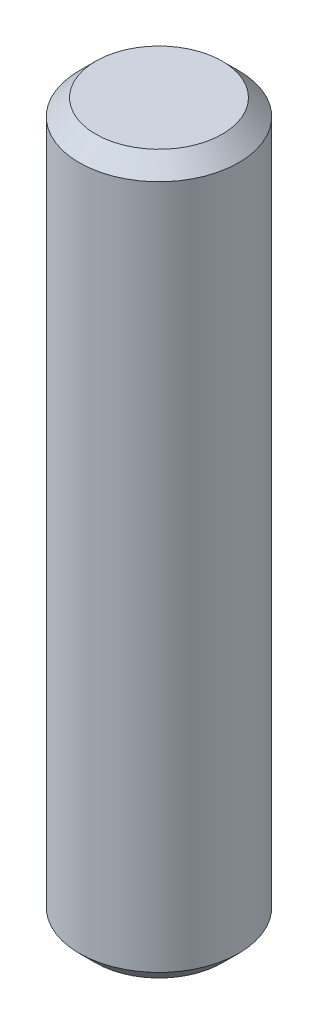
from build123d import *

# Parameters (mm, degrees)
SKETCH1_R           = 2
BOSS_EXTRUDE1_DEPTH = 18
CHAMFER1_SIZE       = 0.413


with BuildPart() as part:
    # Sketch1 → Boss-Extrude1 (new body)
    with BuildSketch(Plane(origin=(0, 0, 0), x_dir=(1, 0, 0), z_dir=(0, 1, 0))):
        with Locations(Location((0, 0, 0), (0, 0, 270))):
            Circle(SKETCH1_R)
    extrude(amount=BOSS_EXTRUDE1_DEPTH)

    # Chamfer1
    chamfer1_edges = [part.edges().sort_by_distance(p)[0] for p in [
        (0, 0, -2),
        (0, 18, -2),
    ]]
    chamfer(chamfer1_edges, length=CHAMFER1_SIZE)


solid = part.part
